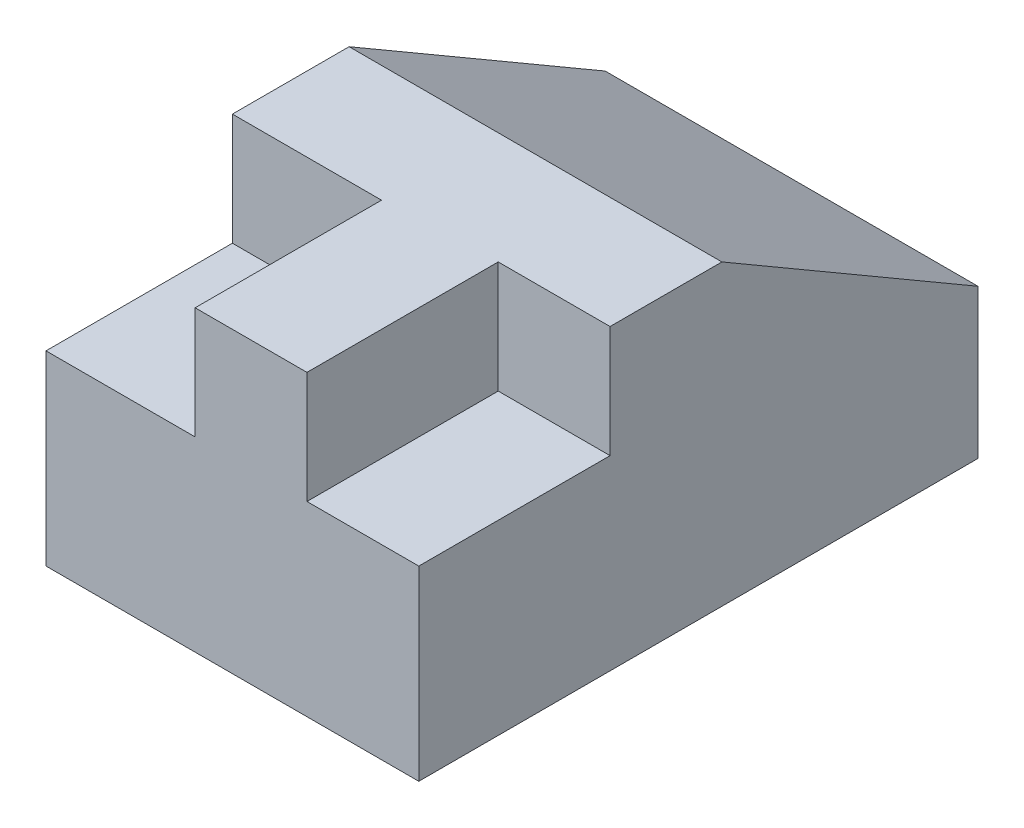
from build123d import *

# Parameters (mm, degrees)
SKETCH3_W               = 100
SKETCH3_H               = 150
BOSS_EXTRUDE2_DEPTH     = 80
CUT_EXTRUDE4_DEPTH      = 100
CUT_EXTRUDE5_DEPTH      = 149.408220797
CUT_EXTRUDE5_DEPTH_BACK = 30
SKETCH4_5_W             = 51.304080983
SKETCH4_5_H             = 30
SKETCH6_W               = 40
SKETCH6_H               = 50
CUT_EXTRUDE6_DEPTH      = 30


with BuildPart() as part:
    # Sketch3 → Boss-Extrude2 (new body)
    with BuildSketch(Plane(origin=(0, 0, 0), x_dir=(1, 0, 0), z_dir=(0, 1, 0))):
        Rectangle(SKETCH3_W, SKETCH3_H)
    extrude(amount=BOSS_EXTRUDE2_DEPTH)

    # Sketch4 → Cut-Extrude4 (cut)
    with BuildSketch(Plane(origin=(50, 0, 0), x_dir=(0, 0, -1), z_dir=(1, 0, 0))):
        Polygon((75, 80), (6.304080983, 80), (75, 40), align=None)
    extrude(amount=-CUT_EXTRUDE4_DEPTH, mode=Mode.SUBTRACT)

    # Sketch4<5> → Cut-Extrude5 (cut, two sides: drawn at the far end of the back side and taken through both)
    with BuildSketch(Plane(origin=(50, 0, 0), x_dir=(0, 0, -1), z_dir=(1, 0, 0)).offset(-CUT_EXTRUDE5_DEPTH_BACK)):
        with Locations((-49.347959508, 65)):
            Rectangle(SKETCH4_5_W, SKETCH4_5_H)
    extrude(amount=CUT_EXTRUDE5_DEPTH + CUT_EXTRUDE5_DEPTH_BACK, mode=Mode.SUBTRACT)

    # Sketch6 → Cut-Extrude6 (cut)
    with BuildSketch(Plane(origin=(0, 80, 0), x_dir=(1, 0, 0), z_dir=(0, 1, 0))):
        with Locations((-30, -50)):
            Rectangle(SKETCH6_W, SKETCH6_H)
    extrude(amount=-CUT_EXTRUDE6_DEPTH, mode=Mode.SUBTRACT)


solid = part.part
